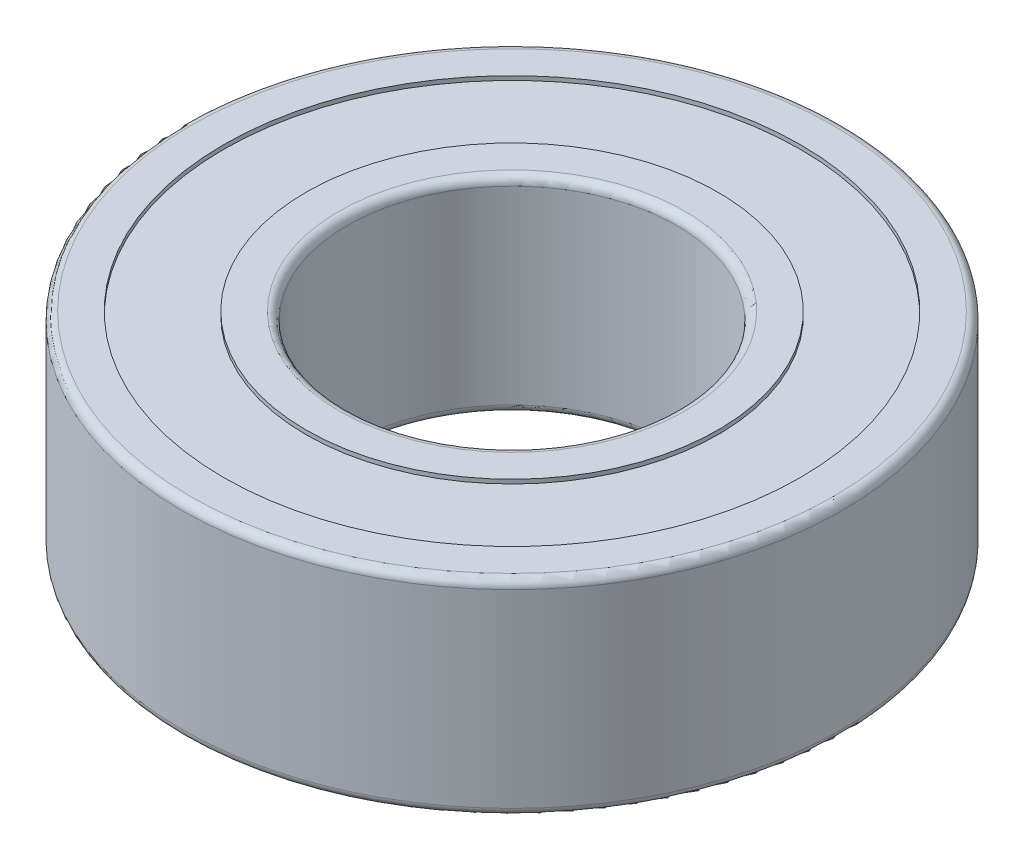
from build123d import *

# Parameters (mm, degrees)
SKETCH1_R           = 8
SKETCH1_R_2         = 4
BOSS_EXTRUDE1_DEPTH = 5
FILLET1_R           = 0.2
SKETCH2_R           = 7
SKETCH2_R_2         = 5
CUT_EXTRUDE1_DEPTH  = 0.1
CUT_EXTRUDE2_START  = -0.1
SKETCH3_R           = 7
SKETCH3_R_2         = 5
CUT_EXTRUDE2_DEPTH  = 0.1


with BuildPart() as part:
    # Sketch1 → Boss-Extrude1 (new body)
    with BuildSketch(Plane(origin=(0, 0, 0), x_dir=(1, 0, 0), z_dir=(0, 1, 0))):
        with Locations(Location((0, 0, 0), (0, 0, 270))):
            Circle(SKETCH1_R)
        with Locations(Location((0, 0, 0), (0, 0, 270))):
            Circle(SKETCH1_R_2, mode=Mode.SUBTRACT)
    extrude(amount=BOSS_EXTRUDE1_DEPTH)

    # Fillet1
    fillet1_edges = [part.edges().sort_by_distance(p)[0] for p in [
        (0, 0, -8),
        (0, 5, -8),
        (0, 0, -4),
        (0, 5, -4),
    ]]
    fillet(fillet1_edges, radius=FILLET1_R)

    # Sketch2 → Cut-Extrude1 (cut)
    with BuildSketch(Plane(origin=(0, 5, 0), x_dir=(1, 0, 0), z_dir=(0, 1, 0))):
        with Locations(Location((0, 0, 0), (0, 0, 270))):
            Circle(SKETCH2_R)
        with Locations(Location((0, 0, 0), (0, 0, 270))):
            Circle(SKETCH2_R_2, mode=Mode.SUBTRACT)
    extrude(amount=-CUT_EXTRUDE1_DEPTH, mode=Mode.SUBTRACT)

    # Sketch3 → Cut-Extrude2 (cut)
    with BuildSketch(Plane.XZ.offset(CUT_EXTRUDE2_START)):
        with Locations(Location((0, 0, 0), (0, 0, 90))):
            Circle(SKETCH3_R)
        with Locations(Location((0, 0, 0), (0, 0, 90))):
            Circle(SKETCH3_R_2, mode=Mode.SUBTRACT)
    extrude(amount=CUT_EXTRUDE2_DEPTH, mode=Mode.SUBTRACT)


solid = part.part
